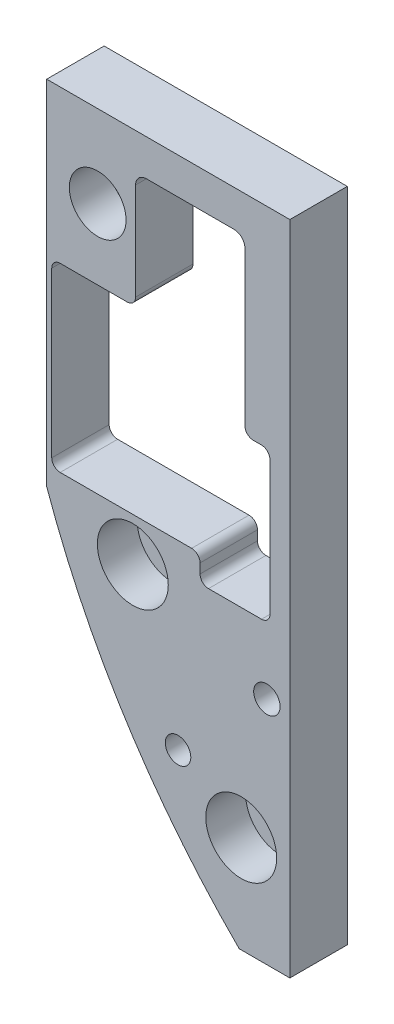
from build123d import *

# Parameters (mm, degrees)
SKETCH1_R           = 2.15265
SKETCH1_R_2         = 2.487009827
SKETCH1_R_3         = 2.39450721
BOSS_EXTRUDE1_DEPTH = 10.8
SKETCH3_R           = 6.6675
SKETCH3_R_2         = 5.334
CUT_EXTRUDE1_DEPTH  = 7.5


with BuildPart() as part:
    # Sketch1 → Boss-Extrude1 (new body)
    with BuildSketch(Plane.XY):
        with BuildLine():
            Line((0, -17.78), (-45.72, -17.78))
            Line((-45.72, -17.78), (-45.72, -84.1375))
            ThreePointArc((-45.72, -84.1375), (-30.833523511, -114.746148224), (-9.525, -141.2875))
            Line((-9.525, -141.2875), (0, -141.2875))
            Line((0, -141.2875), (0, -17.78))
        make_face()
        with Locations(Location((-36.1315, -33.274, 0), (0, 0, 180))):
            Circle(SKETCH1_R, mode=Mode.SUBTRACT)
        with Locations(Location((-29.5275, -88.7095, 0), (0, 0, 180))):
            Circle(SKETCH1_R, mode=Mode.SUBTRACT)
        with Locations(Location((-9.144, -122.9995, 0), (0, 0, 180))):
            Circle(SKETCH1_R, mode=Mode.SUBTRACT)
        with Locations(Location((-4.3173518, -98.035919174, 0), (0, 0, 180))):
            Circle(SKETCH1_R_2, mode=Mode.SUBTRACT)
        with Locations(Location((-21.024674116, -114.680376144, 0), (0, 0, 180))):
            Circle(SKETCH1_R_3, mode=Mode.SUBTRACT)
        with BuildLine():
            Line((-30.5943, -46.501483685), (-43.185677441, -46.501483685))
            ThreePointArc((-43.185677441, -46.501483685), (-44.308209457, -46.96645167), (-44.773177441, -48.088983685))
            Line((-44.773177441, -48.088983685), (-44.773177441, -78.965225138))
            ThreePointArc((-44.773177441, -78.965225138), (-44.308209457, -80.087757153), (-43.185677441, -80.552725138))
            Line((-43.185677441, -80.552725138), (-18.474223541, -80.552725138))
            ThreePointArc((-18.474223541, -80.552725138), (-17.351691526, -81.017693123), (-16.886723541, -82.140225138))
            Line((-16.886723541, -82.140225138), (-16.886723541, -83.937143103))
            ThreePointArc((-16.886723541, -83.937143103), (-16.421755557, -85.059675118), (-15.299223541, -85.524643103))
            Line((-15.299223541, -85.524643103), (-5.327492268, -85.524643103))
            ThreePointArc((-5.327492268, -85.524643103), (-4.204960252, -85.059675118), (-3.739992268, -83.937143103))
            Line((-3.739992268, -83.937143103), (-3.739992268, -58.7502))
            ThreePointArc((-3.739992268, -58.7502), (-4.204960252, -57.627667985), (-5.327492268, -57.1627))
            Line((-5.327492268, -57.1627), (-6.8707, -57.1627))
            ThreePointArc((-6.8707, -57.1627), (-7.993232015, -56.697732015), (-8.4582, -55.5752))
            Line((-8.4582, -55.5752), (-8.4582, -26.6573))
            ThreePointArc((-8.4582, -26.6573), (-9.053359021, -25.220459021), (-10.4902, -24.6253))
            Line((-10.4902, -24.6253), (-26.9748, -24.6253))
            ThreePointArc((-26.9748, -24.6253), (-28.411640979, -25.220459021), (-29.0068, -26.6573))
            Line((-29.0068, -26.6573), (-29.0068, -44.913983685))
            ThreePointArc((-29.0068, -44.913983685), (-29.471767985, -46.036515701), (-30.5943, -46.501483685))
        make_face(mode=Mode.SUBTRACT)
    extrude(amount=BOSS_EXTRUDE1_DEPTH)

    # Sketch3 → Cut-Extrude1 (cut)
    with BuildSketch(Plane.XY.offset(10.8)):
        with Locations((-9.144, -122.9995)):
            Circle(SKETCH3_R)
        with Locations((-29.5275, -88.7095)):
            Circle(SKETCH3_R)
        with Locations((-36.1315, -33.274)):
            Circle(SKETCH3_R_2)
    extrude(amount=-CUT_EXTRUDE1_DEPTH, mode=Mode.SUBTRACT)


solid = part.part
